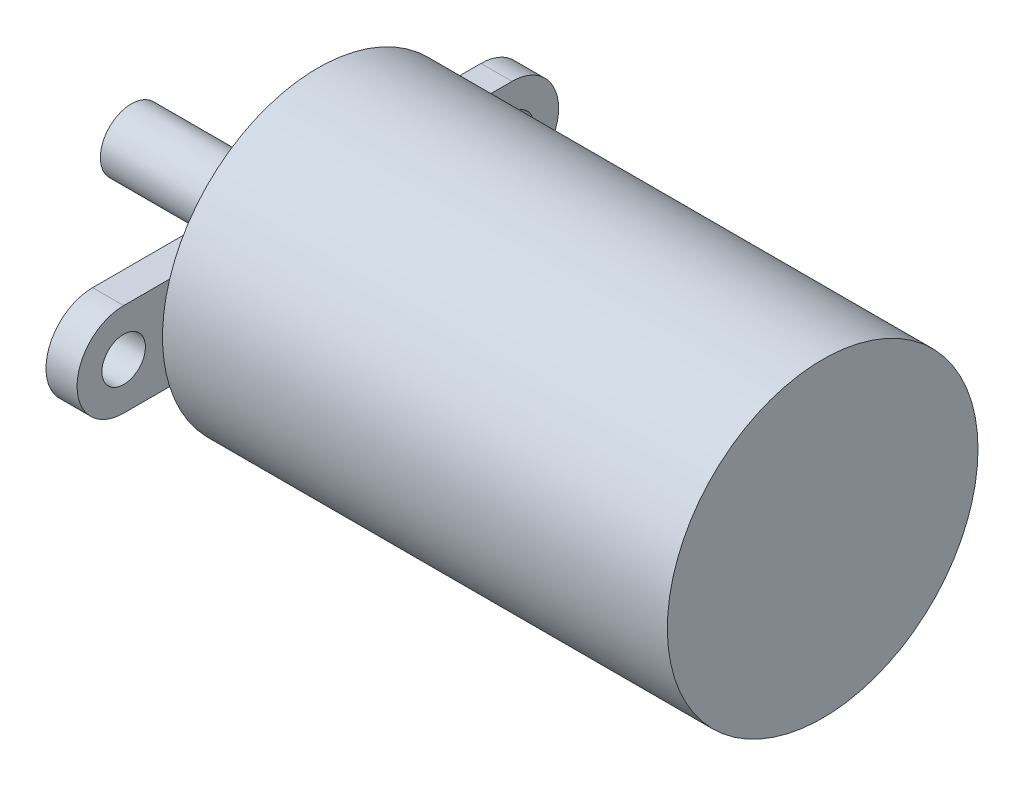
from build123d import *

# Parameters (mm, degrees)
SKETCH1_R                      = 10
BOSS_EXTRUDE1_DEPTH            = 32.5
BOSS_EXTRUDE2_DEPTH            = 2
F_2_8_2_8_DIAMETER_HOLE1_D     = 2.8
F_2_8_2_8_DIAMETER_HOLE1_DEPTH = 70
F_2_8_2_8_DIAMETER_HOLE1_TIP   = 0.841204867
SKETCH5_R                      = 4
BOSS_EXTRUDE3_DEPTH            = 2
SKETCH6_R                      = 2
BOSS_EXTRUDE4_DEPTH            = 8


with BuildPart() as part:
    # Sketch1 → Boss-Extrude1 (new body)
    with BuildSketch(Plane(origin=(0, 0, 0), x_dir=(0, 0, -1), z_dir=(1, 0, 0))):
        Circle(SKETCH1_R)
    extrude(amount=BOSS_EXTRUDE1_DEPTH)

    # Sketch2 → Boss-Extrude2 (add)
    with BuildSketch(Plane.ZY):
        with BuildLine():
            Line((-12.5, 3), (12.5, 3))
            ThreePointArc((12.5, 3), (15.5, 0), (12.5, -3))
            Line((12.5, -3), (-12.5, -3))
            ThreePointArc((-12.5, -3), (-15.5, 0), (-12.5, 3))
        make_face()
    extrude(amount=BOSS_EXTRUDE2_DEPTH)

    # Ø2.8 (2.8) Diameter Hole1
    with Locations(Plane.ZY.offset(2)):
        with Locations((-12.5, -0.140336266), (12.5, 0)):
            Hole(F_2_8_2_8_DIAMETER_HOLE1_D / 2, depth=F_2_8_2_8_DIAMETER_HOLE1_DEPTH)
            with Locations((0, 0, -(F_2_8_2_8_DIAMETER_HOLE1_DEPTH + F_2_8_2_8_DIAMETER_HOLE1_TIP / 2))):  # 118° drill point
                Cone(0, F_2_8_2_8_DIAMETER_HOLE1_D / 2, F_2_8_2_8_DIAMETER_HOLE1_TIP, mode=Mode.SUBTRACT)

    # Sketch5 → Boss-Extrude3 (add)
    with BuildSketch(Plane.ZY.offset(2)):
        with Locations(Location((0, 0, 0), (0, 0, 228.590377891))):
            Circle(SKETCH5_R)
    extrude(amount=BOSS_EXTRUDE3_DEPTH)

    # Sketch6 → Boss-Extrude4 (add)
    with BuildSketch(Plane.ZY.offset(4)):
        Circle(SKETCH6_R)
    extrude(amount=BOSS_EXTRUDE4_DEPTH)


solid = part.part
